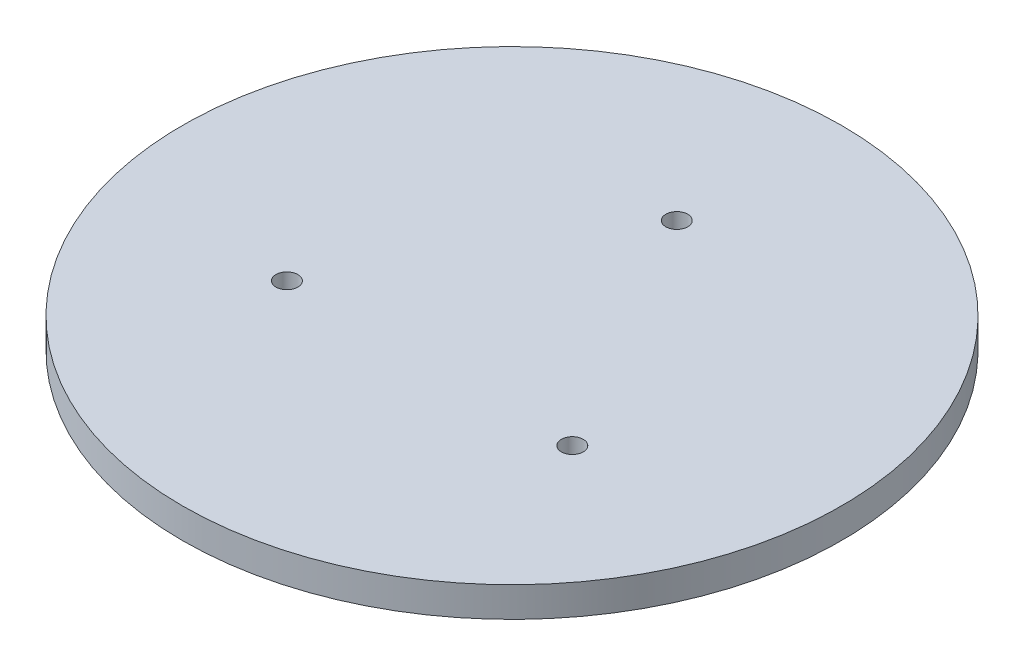
from build123d import *

# Parameters (mm, degrees)
SKETCH1_R           = 69.596
SKETCH1_R_2         = 2.3114
BOSS_EXTRUDE1_DEPTH = 6.35


with BuildPart() as part:
    # Sketch1 → Boss-Extrude1 (new body)
    with BuildSketch(Plane(origin=(0, 0, 0), x_dir=(1, 0, 0), z_dir=(0, 1, 0))):
        with Locations(Location((0, 0, 0), (0, 0, 270))):
            Circle(SKETCH1_R)
        with Locations(Location((0, 34.798, 0), (0, 0, 270))):
            Circle(SKETCH1_R_2, mode=Mode.SUBTRACT)
        with Locations(Location((30.135952001, -17.399, 0), (0, 0, 270))):
            Circle(SKETCH1_R_2, mode=Mode.SUBTRACT)
        with Locations(Location((-30.135952001, -17.399, 0), (0, 0, 270))):
            Circle(SKETCH1_R_2, mode=Mode.SUBTRACT)
    extrude(amount=BOSS_EXTRUDE1_DEPTH)


solid = part.part
